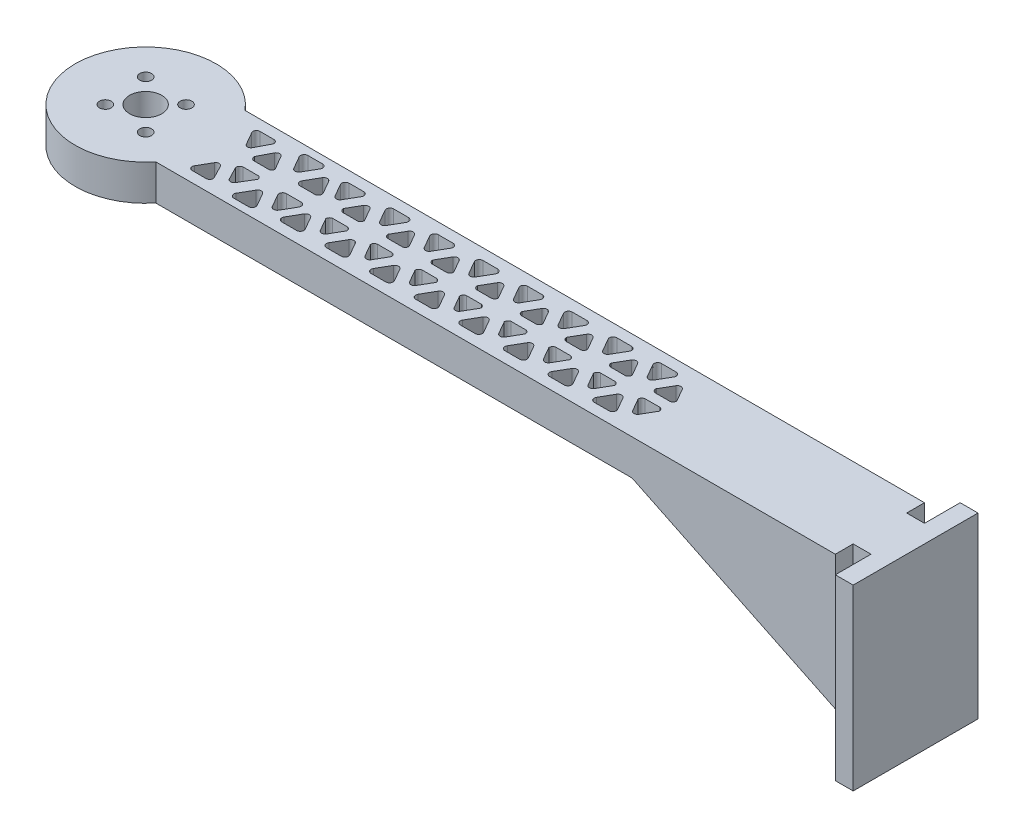
from build123d import *

# Parameters (mm, degrees)
SKETCH1_R           = 1.65
SKETCH1_R_2         = 4.5
BOSS_EXTRUDE1_DEPTH = 10
BOSS_EXTRUDE2_DEPTH = 50
BOSS_EXTRUDE3_DEPTH = 25
CUT_EXTRUDE1_REACH  = 224.387
SKETCH2_4_W         = 5
SKETCH2_4_H         = 5


with BuildPart() as part:
    # Sketch1 → Boss-Extrude1 (new body)
    with BuildSketch(Plane(origin=(0, 0, 0), x_dir=(1, 0, 0), z_dir=(0, 1, 0))):
        with BuildLine():
            Line((215.781228136, 12.419661208), (15.251683783, 12.419661208))
            ThreePointArc((15.251683783, 12.419661208), (-19.862171776, -0.080338792), (15.251683783, -12.580338792))
            Line((15.251683783, -12.580338792), (215.781228136, -12.580338792))
            Line((215.781228136, -12.580338792), (215.781228136, 12.419661208))
        make_face()
        with BuildLine():
            ThreePointArc((40.028484267, -8.923117966), (40.028697604, -9.947176998), (39.141872006, -10.459268109))
            Line((39.141872006, -10.459268109), (35.007344818, -10.459268109))
            ThreePointArc((35.007344818, -10.459268109), (34.12051922, -9.947176998), (34.120732557, -8.923117966))
            Line((34.120732557, -8.923117966), (36.187996151, -5.34480815))
            ThreePointArc((36.187996151, -5.34480815), (37.074608412, -4.833086491), (37.961220673, -5.34480815))
            Line((37.961220673, -5.34480815), (40.028484267, -8.923117966))
        make_face(mode=Mode.SUBTRACT)
        with BuildLine():
            Line((21.614703637, -8.12452744), (23.681967231, -4.546217624))
            ThreePointArc((23.681967231, -4.546217624), (24.543612682, -4.061494427), (25.383043849, -4.583744154))
            Line((25.383043849, -4.583744154), (27.244871966, -8.162053969))
            ThreePointArc((27.244871966, -8.162053969), (27.213581729, -9.113447541), (26.384038862, -9.580338792))
            Line((26.384038862, -9.580338792), (22.454947151, -9.580338792))
            ThreePointArc((22.454947151, -9.580338792), (21.614501458, -9.095029425), (21.614703637, -8.12452744))
        make_face(mode=Mode.SUBTRACT)
        with BuildLine():
            ThreePointArc((27.803132488, -2.735420106), (28.041756396, -1.959117555), (28.760166912, -1.580338792))
            Line((28.760166912, -1.580338792), (33.170984506, -1.580338792))
            ThreePointArc((33.170984506, -1.580338792), (33.622927159, -1.975727629), (33.775469807, -2.556516089))
            Line((33.775469807, -2.556516089), (31.573625479, -6.255367121))
            ThreePointArc((31.573625479, -6.255367121), (30.697555502, -6.931576396), (29.718236674, -6.416122982))
            Line((29.718236674, -6.416122982), (27.803132488, -2.735420106))
        make_face(mode=Mode.SUBTRACT)
        with BuildLine():
            Line((46.634703637, -7.963849857), (48.701967231, -4.385540041))
            ThreePointArc((48.701967231, -4.385540041), (49.588579492, -3.873818381), (50.475191753, -4.385540041))
            Line((50.475191753, -4.385540041), (52.542455347, -7.963849857))
            ThreePointArc((52.542455347, -7.963849857), (52.542668684, -8.987908889), (51.655843086, -9.5))
            Line((51.655843086, -9.5), (47.521315898, -9.5))
            ThreePointArc((47.521315898, -9.5), (46.6344903, -8.987908889), (46.634703637, -7.963849857))
        make_face(mode=Mode.SUBTRACT)
        with BuildLine():
            Line((59.144703637, -7.963849857), (61.211967231, -4.385540041))
            ThreePointArc((61.211967231, -4.385540041), (62.098579492, -3.873818381), (62.985191753, -4.385540041))
            Line((62.985191753, -4.385540041), (65.052455347, -7.963849857))
            ThreePointArc((65.052455347, -7.963849857), (65.052668684, -8.987908889), (64.165843086, -9.5))
            Line((64.165843086, -9.5), (60.031315898, -9.5))
            ThreePointArc((60.031315898, -9.5), (59.1444903, -8.987908889), (59.144703637, -7.963849857))
        make_face(mode=Mode.SUBTRACT)
        with BuildLine():
            Line((71.654703637, -7.963849857), (73.721967231, -4.385540041))
            ThreePointArc((73.721967231, -4.385540041), (74.608579492, -3.873818381), (75.495191753, -4.385540041))
            Line((75.495191753, -4.385540041), (77.562455347, -7.963849857))
            ThreePointArc((77.562455347, -7.963849857), (77.562668684, -8.987908889), (76.675843086, -9.5))
            Line((76.675843086, -9.5), (72.541315898, -9.5))
            ThreePointArc((72.541315898, -9.5), (71.6544903, -8.987908889), (71.654703637, -7.963849857))
        make_face(mode=Mode.SUBTRACT)
        with BuildLine():
            Line((84.164703637, -7.963849857), (86.231967231, -4.385540041))
            ThreePointArc((86.231967231, -4.385540041), (87.118579492, -3.873818381), (88.005191753, -4.385540041))
            Line((88.005191753, -4.385540041), (90.072455347, -7.963849857))
            ThreePointArc((90.072455347, -7.963849857), (90.072668684, -8.987908889), (89.185843086, -9.5))
            Line((89.185843086, -9.5), (85.051315898, -9.5))
            ThreePointArc((85.051315898, -9.5), (84.1644903, -8.987908889), (84.164703637, -7.963849857))
        make_face(mode=Mode.SUBTRACT)
        with BuildLine():
            Line((46.281498727, -3.523632181), (44.214235133, -7.101941997))
            ThreePointArc((44.214235133, -7.101941997), (43.327622872, -7.613663657), (42.441010611, -7.101941997))
            Line((42.441010611, -7.101941997), (40.373261673, -3.514943175))
            ThreePointArc((40.373261673, -3.514943175), (40.373776477, -2.491304726), (41.260359278, -1.979634055))
            Line((41.260359278, -1.979634055), (45.394886466, -1.979634055))
            ThreePointArc((45.394886466, -1.979634055), (46.287424275, -2.493670166), (46.281498727, -3.523632181))
        make_face(mode=Mode.SUBTRACT)
        with BuildLine():
            ThreePointArc((52.887718097, -2.564364072), (53.123716588, -1.859495358), (53.774330358, -1.5))
            Line((53.774330358, -1.5), (57.908857546, -1.5))
            ThreePointArc((57.908857546, -1.5), (58.556731527, -1.85658781), (58.795469807, -2.556516089))
            Line((58.795469807, -2.556516089), (56.728206213, -6.142673887))
            ThreePointArc((56.728206213, -6.142673887), (55.841593952, -6.654395547), (54.954981691, -6.142673887))
            Line((54.954981691, -6.142673887), (52.887718097, -2.564364072))
        make_face(mode=Mode.SUBTRACT)
        with BuildLine():
            ThreePointArc((65.397718097, -2.564364072), (65.633716588, -1.859495358), (66.284330358, -1.5))
            Line((66.284330358, -1.5), (70.418857546, -1.5))
            ThreePointArc((70.418857546, -1.5), (71.066731527, -1.85658781), (71.305469807, -2.556516089))
            Line((71.305469807, -2.556516089), (69.238206213, -6.142673887))
            ThreePointArc((69.238206213, -6.142673887), (68.351593952, -6.654395547), (67.464981691, -6.142673887))
            Line((67.464981691, -6.142673887), (65.397718097, -2.564364072))
        make_face(mode=Mode.SUBTRACT)
        with BuildLine():
            ThreePointArc((77.907718097, -2.564364072), (78.143716588, -1.859495358), (78.794330358, -1.5))
            Line((78.794330358, -1.5), (82.928857546, -1.5))
            ThreePointArc((82.928857546, -1.5), (83.576731527, -1.85658781), (83.815469807, -2.556516089))
            Line((83.815469807, -2.556516089), (81.748206213, -6.142673887))
            ThreePointArc((81.748206213, -6.142673887), (80.861593952, -6.654395547), (79.974981691, -6.142673887))
            Line((79.974981691, -6.142673887), (77.907718097, -2.564364072))
        make_face(mode=Mode.SUBTRACT)
        with BuildLine():
            ThreePointArc((90.417718097, -2.564364072), (90.653716588, -1.859495358), (91.304330358, -1.5))
            Line((91.304330358, -1.5), (95.438857546, -1.5))
            ThreePointArc((95.438857546, -1.5), (96.086731527, -1.85658781), (96.325469807, -2.556516089))
            Line((96.325469807, -2.556516089), (94.258206213, -6.142673887))
            ThreePointArc((94.258206213, -6.142673887), (93.371593952, -6.654395547), (92.484981691, -6.142673887))
            Line((92.484981691, -6.142673887), (90.417718097, -2.564364072))
        make_face(mode=Mode.SUBTRACT)
        with BuildLine():
            Line((96.674703637, -7.963849857), (98.741967231, -4.385540041))
            ThreePointArc((98.741967231, -4.385540041), (99.628579492, -3.873818381), (100.515191753, -4.385540041))
            Line((100.515191753, -4.385540041), (102.582455347, -7.963849857))
            ThreePointArc((102.582455347, -7.963849857), (102.582668684, -8.987908889), (101.695843086, -9.5))
            Line((101.695843086, -9.5), (97.561315898, -9.5))
            ThreePointArc((97.561315898, -9.5), (96.6744903, -8.987908889), (96.674703637, -7.963849857))
        make_face(mode=Mode.SUBTRACT)
        with BuildLine():
            Line((109.184703637, -7.963849857), (111.251967231, -4.385540041))
            ThreePointArc((111.251967231, -4.385540041), (112.138579492, -3.873818381), (113.025191753, -4.385540041))
            Line((113.025191753, -4.385540041), (115.092455347, -7.963849857))
            ThreePointArc((115.092455347, -7.963849857), (115.092668684, -8.987908889), (114.205843086, -9.5))
            Line((114.205843086, -9.5), (110.071315898, -9.5))
            ThreePointArc((110.071315898, -9.5), (109.1844903, -8.987908889), (109.184703637, -7.963849857))
        make_face(mode=Mode.SUBTRACT)
        with BuildLine():
            Line((121.694703637, -7.963849857), (123.761967231, -4.385540041))
            ThreePointArc((123.761967231, -4.385540041), (124.648579492, -3.873818381), (125.535191753, -4.385540041))
            Line((125.535191753, -4.385540041), (127.602455347, -7.963849857))
            ThreePointArc((127.602455347, -7.963849857), (127.602668684, -8.987908889), (126.715843086, -9.5))
            Line((126.715843086, -9.5), (122.581315898, -9.5))
            ThreePointArc((122.581315898, -9.5), (121.6944903, -8.987908889), (121.694703637, -7.963849857))
        make_face(mode=Mode.SUBTRACT)
        with BuildLine():
            Line((134.204703637, -7.963849857), (136.271967231, -4.385540041))
            ThreePointArc((136.271967231, -4.385540041), (137.158579492, -3.873818381), (138.045191753, -4.385540041))
            Line((138.045191753, -4.385540041), (140.112455347, -7.963849857))
            ThreePointArc((140.112455347, -7.963849857), (140.112668684, -8.987908889), (139.225843086, -9.5))
            Line((139.225843086, -9.5), (135.091315898, -9.5))
            ThreePointArc((135.091315898, -9.5), (134.2044903, -8.987908889), (134.204703637, -7.963849857))
        make_face(mode=Mode.SUBTRACT)
        with BuildLine():
            ThreePointArc((102.927718097, -2.564364072), (103.163716588, -1.859495358), (103.814330358, -1.5))
            Line((103.814330358, -1.5), (107.948857546, -1.5))
            ThreePointArc((107.948857546, -1.5), (108.596731527, -1.85658781), (108.835469807, -2.556516089))
            Line((108.835469807, -2.556516089), (106.768206213, -6.142673887))
            ThreePointArc((106.768206213, -6.142673887), (105.881593952, -6.654395547), (104.994981691, -6.142673887))
            Line((104.994981691, -6.142673887), (102.927718097, -2.564364072))
        make_face(mode=Mode.SUBTRACT)
        with BuildLine():
            ThreePointArc((115.437718097, -2.564364072), (115.673716588, -1.859495358), (116.324330358, -1.5))
            Line((116.324330358, -1.5), (120.458857546, -1.5))
            ThreePointArc((120.458857546, -1.5), (121.106731527, -1.85658781), (121.345469807, -2.556516089))
            Line((121.345469807, -2.556516089), (119.278206213, -6.142673887))
            ThreePointArc((119.278206213, -6.142673887), (118.391593952, -6.654395547), (117.504981691, -6.142673887))
            Line((117.504981691, -6.142673887), (115.437718097, -2.564364072))
        make_face(mode=Mode.SUBTRACT)
        with BuildLine():
            ThreePointArc((127.947718097, -2.564364072), (128.183716588, -1.859495358), (128.834330358, -1.5))
            Line((128.834330358, -1.5), (132.968857546, -1.5))
            ThreePointArc((132.968857546, -1.5), (133.616731527, -1.85658781), (133.855469807, -2.556516089))
            Line((133.855469807, -2.556516089), (131.788206213, -6.142673887))
            ThreePointArc((131.788206213, -6.142673887), (130.901593952, -6.654395547), (130.014981691, -6.142673887))
            Line((130.014981691, -6.142673887), (127.947718097, -2.564364072))
        make_face(mode=Mode.SUBTRACT)
        with BuildLine():
            ThreePointArc((140.457718097, -2.564364072), (140.693716588, -1.859495358), (141.344330358, -1.5))
            Line((141.344330358, -1.5), (145.478857546, -1.5))
            ThreePointArc((145.478857546, -1.5), (146.126731527, -1.85658781), (146.365469807, -2.556516089))
            Line((146.365469807, -2.556516089), (144.298206213, -6.142673887))
            ThreePointArc((144.298206213, -6.142673887), (143.411593952, -6.654395547), (142.524981691, -6.142673887))
            Line((142.524981691, -6.142673887), (140.457718097, -2.564364072))
        make_face(mode=Mode.SUBTRACT)
        with BuildLine():
            Line((27.803132488, 2.574742523), (29.718236674, 6.255445399))
            ThreePointArc((29.718236674, 6.255445399), (30.697555502, 6.770898813), (31.573625479, 6.094689538))
            Line((31.573625479, 6.094689538), (33.775469807, 2.395838506))
            ThreePointArc((33.775469807, 2.395838506), (33.622927159, 1.815050046), (33.170984506, 1.419661208))
            Line((33.170984506, 1.419661208), (28.760166912, 1.419661208))
            ThreePointArc((28.760166912, 1.419661208), (28.041756396, 1.798439972), (27.803132488, 2.574742523))
        make_face(mode=Mode.SUBTRACT)
        with BuildLine():
            ThreePointArc((21.614703637, 7.963849857), (21.614501458, 8.934351842), (22.454947151, 9.419661208))
            Line((22.454947151, 9.419661208), (26.384038862, 9.419661208))
            ThreePointArc((26.384038862, 9.419661208), (27.213581729, 8.952769958), (27.244871966, 8.001376386))
            Line((27.244871966, 8.001376386), (25.383043849, 4.423066571))
            ThreePointArc((25.383043849, 4.423066571), (24.543612682, 3.900816844), (23.681967231, 4.385540041))
            Line((23.681967231, 4.385540041), (21.614703637, 7.963849857))
        make_face(mode=Mode.SUBTRACT)
        with BuildLine():
            Line((40.028484267, 8.762440383), (37.961220673, 5.184130567))
            ThreePointArc((37.961220673, 5.184130567), (37.074608412, 4.672408908), (36.187996151, 5.184130567))
            Line((36.187996151, 5.184130567), (34.120732557, 8.762440383))
            ThreePointArc((34.120732557, 8.762440383), (34.12051922, 9.786499415), (35.007344818, 10.298590526))
            Line((35.007344818, 10.298590526), (39.141872006, 10.298590526))
            ThreePointArc((39.141872006, 10.298590526), (40.028697604, 9.786499415), (40.028484267, 8.762440383))
        make_face(mode=Mode.SUBTRACT)
        with BuildLine():
            ThreePointArc((46.281498727, 3.362954598), (46.287424275, 2.332992583), (45.394886466, 1.818956472))
            Line((45.394886466, 1.818956472), (41.260359278, 1.818956472))
            ThreePointArc((41.260359278, 1.818956472), (40.373776477, 2.330627143), (40.373261673, 3.354265592))
            Line((40.373261673, 3.354265592), (42.441010611, 6.941264414))
            ThreePointArc((42.441010611, 6.941264414), (43.327622872, 7.452986074), (44.214235133, 6.941264414))
            Line((44.214235133, 6.941264414), (46.281498727, 3.362954598))
        make_face(mode=Mode.SUBTRACT)
        with BuildLine():
            Line((52.887718097, 2.403686489), (54.954981691, 5.981996304))
            ThreePointArc((54.954981691, 5.981996304), (55.841593952, 6.493717964), (56.728206213, 5.981996304))
            Line((56.728206213, 5.981996304), (58.795469807, 2.395838506))
            ThreePointArc((58.795469807, 2.395838506), (58.556731527, 1.695910227), (57.908857546, 1.339322417))
            Line((57.908857546, 1.339322417), (53.774330358, 1.339322417))
            ThreePointArc((53.774330358, 1.339322417), (53.123716588, 1.698817775), (52.887718097, 2.403686489))
        make_face(mode=Mode.SUBTRACT)
        with BuildLine():
            Line((65.397718097, 2.403686489), (67.464981691, 5.981996304))
            ThreePointArc((67.464981691, 5.981996304), (68.351593952, 6.493717964), (69.238206213, 5.981996304))
            Line((69.238206213, 5.981996304), (71.305469807, 2.395838506))
            ThreePointArc((71.305469807, 2.395838506), (71.066731527, 1.695910227), (70.418857546, 1.339322417))
            Line((70.418857546, 1.339322417), (66.284330358, 1.339322417))
            ThreePointArc((66.284330358, 1.339322417), (65.633716588, 1.698817775), (65.397718097, 2.403686489))
        make_face(mode=Mode.SUBTRACT)
        with BuildLine():
            Line((77.907718097, 2.403686489), (79.974981691, 5.981996304))
            ThreePointArc((79.974981691, 5.981996304), (80.861593952, 6.493717964), (81.748206213, 5.981996304))
            Line((81.748206213, 5.981996304), (83.815469807, 2.395838506))
            ThreePointArc((83.815469807, 2.395838506), (83.576731527, 1.695910227), (82.928857546, 1.339322417))
            Line((82.928857546, 1.339322417), (78.794330358, 1.339322417))
            ThreePointArc((78.794330358, 1.339322417), (78.143716588, 1.698817775), (77.907718097, 2.403686489))
        make_face(mode=Mode.SUBTRACT)
        with BuildLine():
            Line((90.417718097, 2.403686489), (92.484981691, 5.981996304))
            ThreePointArc((92.484981691, 5.981996304), (93.371593952, 6.493717964), (94.258206213, 5.981996304))
            Line((94.258206213, 5.981996304), (96.325469807, 2.395838506))
            ThreePointArc((96.325469807, 2.395838506), (96.086731527, 1.695910227), (95.438857546, 1.339322417))
            Line((95.438857546, 1.339322417), (91.304330358, 1.339322417))
            ThreePointArc((91.304330358, 1.339322417), (90.653716588, 1.698817775), (90.417718097, 2.403686489))
        make_face(mode=Mode.SUBTRACT)
        with BuildLine():
            ThreePointArc((46.634703637, 7.803172274), (46.6344903, 8.827231306), (47.521315898, 9.339322417))
            Line((47.521315898, 9.339322417), (51.655843086, 9.339322417))
            ThreePointArc((51.655843086, 9.339322417), (52.542668684, 8.827231306), (52.542455347, 7.803172274))
            Line((52.542455347, 7.803172274), (50.475191753, 4.224862458))
            ThreePointArc((50.475191753, 4.224862458), (49.588579492, 3.713140798), (48.701967231, 4.224862458))
            Line((48.701967231, 4.224862458), (46.634703637, 7.803172274))
        make_face(mode=Mode.SUBTRACT)
        with BuildLine():
            ThreePointArc((59.144703637, 7.803172274), (59.1444903, 8.827231306), (60.031315898, 9.339322417))
            Line((60.031315898, 9.339322417), (64.165843086, 9.339322417))
            ThreePointArc((64.165843086, 9.339322417), (65.052668684, 8.827231306), (65.052455347, 7.803172274))
            Line((65.052455347, 7.803172274), (62.985191753, 4.224862458))
            ThreePointArc((62.985191753, 4.224862458), (62.098579492, 3.713140798), (61.211967231, 4.224862458))
            Line((61.211967231, 4.224862458), (59.144703637, 7.803172274))
        make_face(mode=Mode.SUBTRACT)
        with BuildLine():
            ThreePointArc((71.654703637, 7.803172274), (71.6544903, 8.827231306), (72.541315898, 9.339322417))
            Line((72.541315898, 9.339322417), (76.675843086, 9.339322417))
            ThreePointArc((76.675843086, 9.339322417), (77.562668684, 8.827231306), (77.562455347, 7.803172274))
            Line((77.562455347, 7.803172274), (75.495191753, 4.224862458))
            ThreePointArc((75.495191753, 4.224862458), (74.608579492, 3.713140798), (73.721967231, 4.224862458))
            Line((73.721967231, 4.224862458), (71.654703637, 7.803172274))
        make_face(mode=Mode.SUBTRACT)
        with BuildLine():
            ThreePointArc((84.164703637, 7.803172274), (84.1644903, 8.827231306), (85.051315898, 9.339322417))
            Line((85.051315898, 9.339322417), (89.185843086, 9.339322417))
            ThreePointArc((89.185843086, 9.339322417), (90.072668684, 8.827231306), (90.072455347, 7.803172274))
            Line((90.072455347, 7.803172274), (88.005191753, 4.224862458))
            ThreePointArc((88.005191753, 4.224862458), (87.118579492, 3.713140798), (86.231967231, 4.224862458))
            Line((86.231967231, 4.224862458), (84.164703637, 7.803172274))
        make_face(mode=Mode.SUBTRACT)
        with BuildLine():
            Line((102.927718097, 2.403686489), (104.994981691, 5.981996304))
            ThreePointArc((104.994981691, 5.981996304), (105.881593952, 6.493717964), (106.768206213, 5.981996304))
            Line((106.768206213, 5.981996304), (108.835469807, 2.395838506))
            ThreePointArc((108.835469807, 2.395838506), (108.596731527, 1.695910227), (107.948857546, 1.339322417))
            Line((107.948857546, 1.339322417), (103.814330358, 1.339322417))
            ThreePointArc((103.814330358, 1.339322417), (103.163716588, 1.698817775), (102.927718097, 2.403686489))
        make_face(mode=Mode.SUBTRACT)
        with BuildLine():
            Line((115.437718097, 2.403686489), (117.504981691, 5.981996304))
            ThreePointArc((117.504981691, 5.981996304), (118.391593952, 6.493717964), (119.278206213, 5.981996304))
            Line((119.278206213, 5.981996304), (121.345469807, 2.395838506))
            ThreePointArc((121.345469807, 2.395838506), (121.106731527, 1.695910227), (120.458857546, 1.339322417))
            Line((120.458857546, 1.339322417), (116.324330358, 1.339322417))
            ThreePointArc((116.324330358, 1.339322417), (115.673716588, 1.698817775), (115.437718097, 2.403686489))
        make_face(mode=Mode.SUBTRACT)
        with BuildLine():
            Line((127.947718097, 2.403686489), (130.014981691, 5.981996304))
            ThreePointArc((130.014981691, 5.981996304), (130.901593952, 6.493717964), (131.788206213, 5.981996304))
            Line((131.788206213, 5.981996304), (133.855469807, 2.395838506))
            ThreePointArc((133.855469807, 2.395838506), (133.616731527, 1.695910227), (132.968857546, 1.339322417))
            Line((132.968857546, 1.339322417), (128.834330358, 1.339322417))
            ThreePointArc((128.834330358, 1.339322417), (128.183716588, 1.698817775), (127.947718097, 2.403686489))
        make_face(mode=Mode.SUBTRACT)
        with BuildLine():
            Line((140.457718097, 2.403686489), (142.524981691, 5.981996304))
            ThreePointArc((142.524981691, 5.981996304), (143.411593952, 6.493717964), (144.298206213, 5.981996304))
            Line((144.298206213, 5.981996304), (146.365469807, 2.395838506))
            ThreePointArc((146.365469807, 2.395838506), (146.126731527, 1.695910227), (145.478857546, 1.339322417))
            Line((145.478857546, 1.339322417), (141.344330358, 1.339322417))
            ThreePointArc((141.344330358, 1.339322417), (140.693716588, 1.698817775), (140.457718097, 2.403686489))
        make_face(mode=Mode.SUBTRACT)
        with BuildLine():
            ThreePointArc((96.674703637, 7.803172274), (96.6744903, 8.827231306), (97.561315898, 9.339322417))
            Line((97.561315898, 9.339322417), (101.695843086, 9.339322417))
            ThreePointArc((101.695843086, 9.339322417), (102.582668684, 8.827231306), (102.582455347, 7.803172274))
            Line((102.582455347, 7.803172274), (100.515191753, 4.224862458))
            ThreePointArc((100.515191753, 4.224862458), (99.628579492, 3.713140798), (98.741967231, 4.224862458))
            Line((98.741967231, 4.224862458), (96.674703637, 7.803172274))
        make_face(mode=Mode.SUBTRACT)
        with BuildLine():
            ThreePointArc((109.184703637, 7.803172274), (109.1844903, 8.827231306), (110.071315898, 9.339322417))
            Line((110.071315898, 9.339322417), (114.205843086, 9.339322417))
            ThreePointArc((114.205843086, 9.339322417), (115.092668684, 8.827231306), (115.092455347, 7.803172274))
            Line((115.092455347, 7.803172274), (113.025191753, 4.224862458))
            ThreePointArc((113.025191753, 4.224862458), (112.138579492, 3.713140798), (111.251967231, 4.224862458))
            Line((111.251967231, 4.224862458), (109.184703637, 7.803172274))
        make_face(mode=Mode.SUBTRACT)
        with BuildLine():
            ThreePointArc((121.694703637, 7.803172274), (121.6944903, 8.827231306), (122.581315898, 9.339322417))
            Line((122.581315898, 9.339322417), (126.715843086, 9.339322417))
            ThreePointArc((126.715843086, 9.339322417), (127.602668684, 8.827231306), (127.602455347, 7.803172274))
            Line((127.602455347, 7.803172274), (125.535191753, 4.224862458))
            ThreePointArc((125.535191753, 4.224862458), (124.648579492, 3.713140798), (123.761967231, 4.224862458))
            Line((123.761967231, 4.224862458), (121.694703637, 7.803172274))
        make_face(mode=Mode.SUBTRACT)
        with BuildLine():
            ThreePointArc((134.204703637, 7.803172274), (134.2044903, 8.827231306), (135.091315898, 9.339322417))
            Line((135.091315898, 9.339322417), (139.225843086, 9.339322417))
            ThreePointArc((139.225843086, 9.339322417), (140.112668684, 8.827231306), (140.112455347, 7.803172274))
            Line((140.112455347, 7.803172274), (138.045191753, 4.224862458))
            ThreePointArc((138.045191753, 4.224862458), (137.158579492, 3.713140798), (136.271967231, 4.224862458))
            Line((136.271967231, 4.224862458), (134.204703637, 7.803172274))
        make_face(mode=Mode.SUBTRACT)
        with Locations(Location((-6.797853213, 6.63717563, 0), (0, 0, 270))):
            Circle(SKETCH1_R, mode=Mode.SUBTRACT)
        with Locations(Location((5.576515458, 5.576515458, 0), (0, 0, 270))):
            Circle(SKETCH1_R, mode=Mode.SUBTRACT)
        with Locations(Location((-5.737193041, -5.737193041, 0), (0, 0, 270))):
            Circle(SKETCH1_R, mode=Mode.SUBTRACT)
        with Locations(Location((6.63717563, -6.797853213, 0), (0, 0, 270))):
            Circle(SKETCH1_R, mode=Mode.SUBTRACT)
        with Locations(Location((-0.080338792, -0.080338792, 0), (0, 0, 270))):
            Circle(SKETCH1_R_2, mode=Mode.SUBTRACT)
    extrude(amount=BOSS_EXTRUDE1_DEPTH)

    # Sketch2 → Boss-Extrude2 (add)
    with BuildSketch(Plane(origin=(0, 10, 0), x_dir=(1, 0, 0), z_dir=(0, 1, 0))):
        Polygon((215.781228136, -17.580338792), (215.781228136, -12.580338792), (215.781228136, 12.419661208), (215.781228136, 17.419661208), (210.781228136, 17.419661208), (210.781228136, -12.580338792), (210.781228136, -17.580338792), align=None)
    extrude(amount=-BOSS_EXTRUDE2_DEPTH)

    # Sketch3 → Boss-Extrude3 (add)
    with BuildSketch(Plane.XY.offset(12.580338792)):
        Polygon((210.781228136, 0), (148.781228136, 0), (210.781228136, -30), align=None)
    extrude(amount=-BOSS_EXTRUDE3_DEPTH)

    # Cut-Extrude1: up to this plane
    cut_extrude1_end = Plane(origin=(210.781228136, -30, -81.296362639), z_dir=(-0.43556092810428065, -0.9001592514155136, 0))
    # Sketch2<4> → Cut-Extrude1 (cut, up to the surface)
    with BuildSketch(Plane(origin=(0, 10, 0), x_dir=(1, 0, 0), z_dir=(0, 1, 0)), mode=Mode.PRIVATE) as cut_extrude1_sk1:
        with Locations((208.281228136, 9.919661208)):
            Rectangle(SKETCH2_4_W, SKETCH2_4_H)
    cut_extrude1_tool1 = split(extrude(cut_extrude1_sk1.sketch, amount=-CUT_EXTRUDE1_REACH, mode=Mode.PRIVATE), bisect_by=cut_extrude1_end, keep=Keep.BOTH, mode=Mode.PRIVATE)
    add(cut_extrude1_tool1.solids().sort_by_distance((208.281228, 10, -9.919661))[0], mode=Mode.SUBTRACT)
    # Sketch2<4> → Cut-Extrude1 (cut, up to the surface)
    with BuildSketch(Plane(origin=(0, 10, 0), x_dir=(1, 0, 0), z_dir=(0, 1, 0)), mode=Mode.PRIVATE) as cut_extrude1_sk2:
        with Locations((208.281228136, -10.080338792)):
            Rectangle(SKETCH2_4_W, SKETCH2_4_H)
    cut_extrude1_tool2 = split(extrude(cut_extrude1_sk2.sketch, amount=-CUT_EXTRUDE1_REACH, mode=Mode.PRIVATE), bisect_by=cut_extrude1_end, keep=Keep.BOTH, mode=Mode.PRIVATE)
    add(cut_extrude1_tool2.solids().sort_by_distance((208.281228, 10, 10.080339))[0], mode=Mode.SUBTRACT)


solid = part.part
